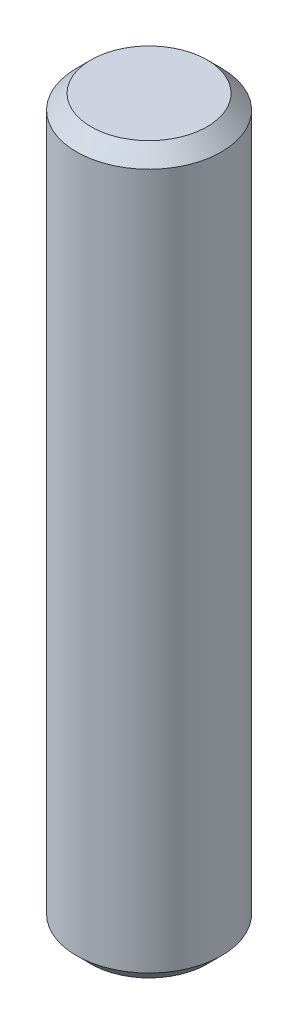
from build123d import *


with BuildPart() as part:
    # Esquisse1 → Base-Révolution (revolve)
    with BuildSketch(Plane.XY, mode=Mode.PRIVATE) as base_r_volution_sk:
        Polygon((2, -19.6), (2, -0.4), (1.6, 0), (0, 0), (0, -20), (1.6, -20), align=None)
    revolve(base_r_volution_sk.sketch.rotate(Axis((0, 0, 0), (0, 1, 0)), 90), axis=Axis((0, 0, 0), (0, 1, 0)))


solid = part.part
